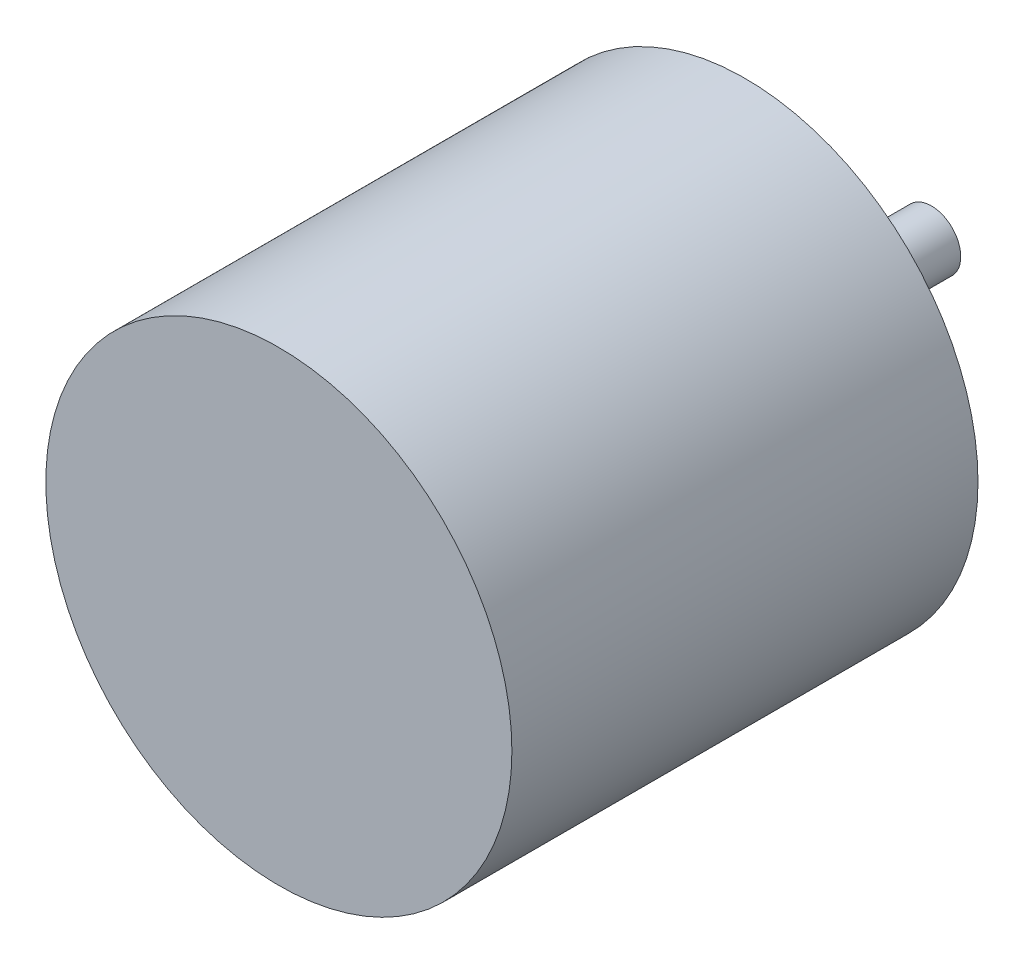
from build123d import *

# Parameters (mm, degrees)
SKETCH1_R           = 12.5
BOSS_EXTRUDE1_DEPTH = 25
SKETCH2_R           = 1.574309685
BOSS_EXTRUDE2_DEPTH = 10


with BuildPart() as part:
    # Sketch1 → Boss-Extrude1 (new body)
    with BuildSketch(Plane.XY):
        Circle(SKETCH1_R)
    extrude(amount=BOSS_EXTRUDE1_DEPTH)

    # Sketch2 → Boss-Extrude2 (add)
    with BuildSketch(Plane.XY):
        Circle(SKETCH2_R)
    extrude(amount=-BOSS_EXTRUDE2_DEPTH)


solid = part.part
